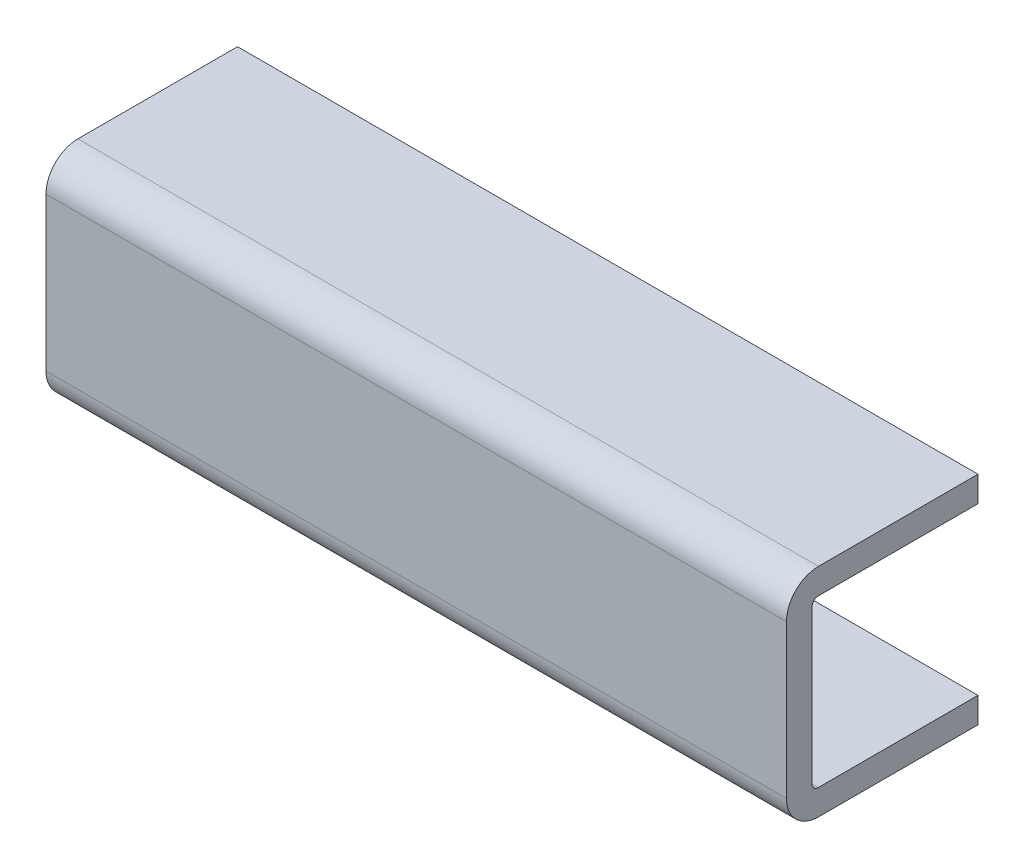
from build123d import *

# Parameters (mm, degrees)
SKETCH1_W           = 184.15
SKETCH1_H           = 53.975
BOSS_EXTRUDE1_DEPTH = 23.8125
FILLET1_R           = 7.9375
SHELL1_T            = -6.35


with BuildPart() as part:
    # Sketch1 → Boss-Extrude1 (new, symmetric)
    with BuildSketch(Plane.XY):
        Rectangle(SKETCH1_W, SKETCH1_H)
    extrude(amount=BOSS_EXTRUDE1_DEPTH, both=True)

    # Fillet1
    fillet1_edges = [part.edges().sort_by_distance(p)[0] for p in [
        (0, 26.9875, 23.8125),
        (0, -26.9875, 23.8125),
    ]]
    fillet(fillet1_edges, radius=FILLET1_R)

    # Shell1
    shell1_openings = [part.faces().sort_by_distance(p)[0] for p in [
        (0, 0, -23.8125),
        (92.075, 0, -0.234313972),
        (-92.075, 0, -0.234313972),
    ]]
    offset(amount=SHELL1_T, openings=shell1_openings, kind=Kind.INTERSECTION)


solid = part.part
